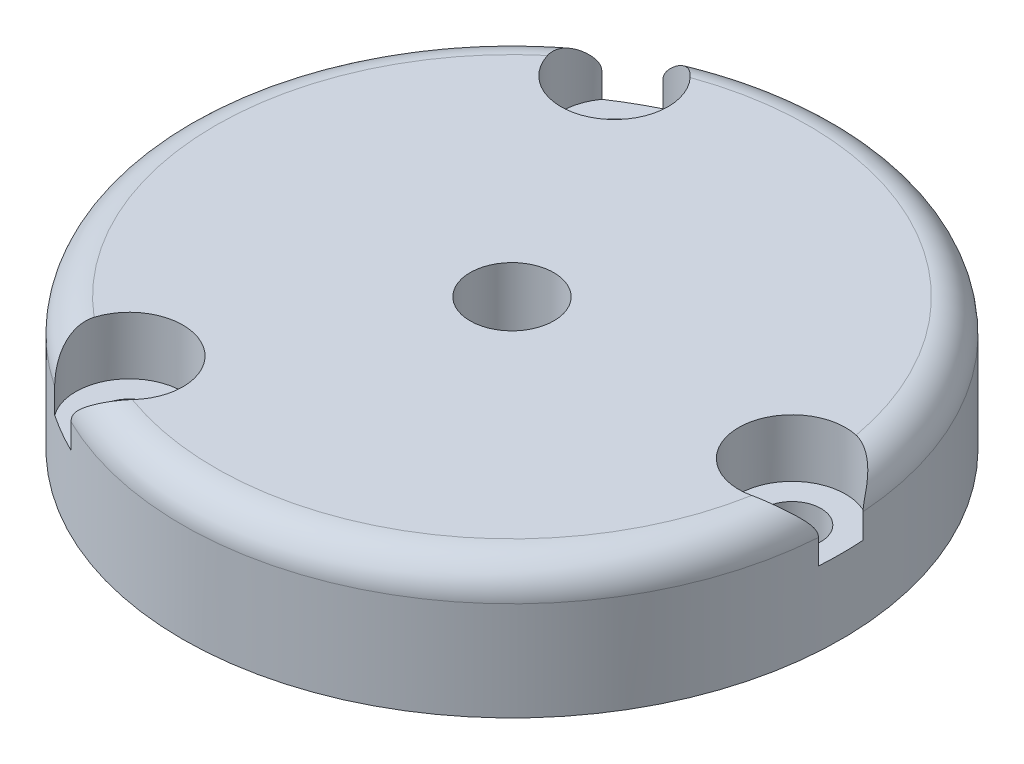
from build123d import *

# Parameters (mm, degrees)
SKETCH1_R           = 20
SKETCH1_R_2         = 1.75
BOSS_EXTRUDE1_DEPTH = 8
SKETCH2_R           = 3.25
CUT_EXTRUDE1_DEPTH  = 3.5
SKETCH3_R           = 2.54000508
CUT_EXTRUDE2_DEPTH  = 30.393876913
FILLET1_R           = 2


with BuildPart() as part:
    # Sketch1 → Boss-Extrude1 (new body)
    with BuildSketch(Plane(origin=(0, 0, 0), x_dir=(1, 0, 0), z_dir=(0, 1, 0))):
        with Locations(Location((0, 0, 0), (0, 0, 270))):
            Circle(SKETCH1_R)
        with Locations(Location((17, 0, 0), (0, 0, 270))):
            Circle(SKETCH1_R_2, mode=Mode.SUBTRACT)
        with Locations(Location((-8.5, -14.722431864, 0), (0, 0, 270))):
            Circle(SKETCH1_R_2, mode=Mode.SUBTRACT)
        with Locations(Location((-8.5, 14.722431864, 0), (0, 0, 270))):
            Circle(SKETCH1_R_2, mode=Mode.SUBTRACT)
    extrude(amount=BOSS_EXTRUDE1_DEPTH)

    # Sketch2 → Cut-Extrude1 (cut)
    with BuildSketch(Plane(origin=(0, 8, 0), x_dir=(1, 0, 0), z_dir=(0, 1, 0))):
        with Locations((17, 0)):
            Circle(SKETCH2_R)
        with Locations((-8.5, -14.722431864)):
            Circle(SKETCH2_R)
        with Locations((-8.5, 14.722431864)):
            Circle(SKETCH2_R)
    extrude(amount=-CUT_EXTRUDE1_DEPTH, mode=Mode.SUBTRACT)

    # Sketch3 → Cut-Extrude2 (cut, through all)
    with BuildSketch(Plane(origin=(0, 8, 0), x_dir=(1, 0, 0), z_dir=(0, 1, 0))):
        with Locations(Location((0, 0, 0), (0, 0, 270))):
            Circle(SKETCH3_R)
    extrude(amount=-CUT_EXTRUDE2_DEPTH, mode=Mode.SUBTRACT)

    # Fillet1
    fillet1_edges = [part.edges().sort_by_distance(p)[0] for p in [
        (10, 8, -17.320508076),
        (-20, 8, 0),
        (13.654656242, 8, 14.613362478),
    ]]
    fillet(fillet1_edges, radius=FILLET1_R)


solid = part.part
